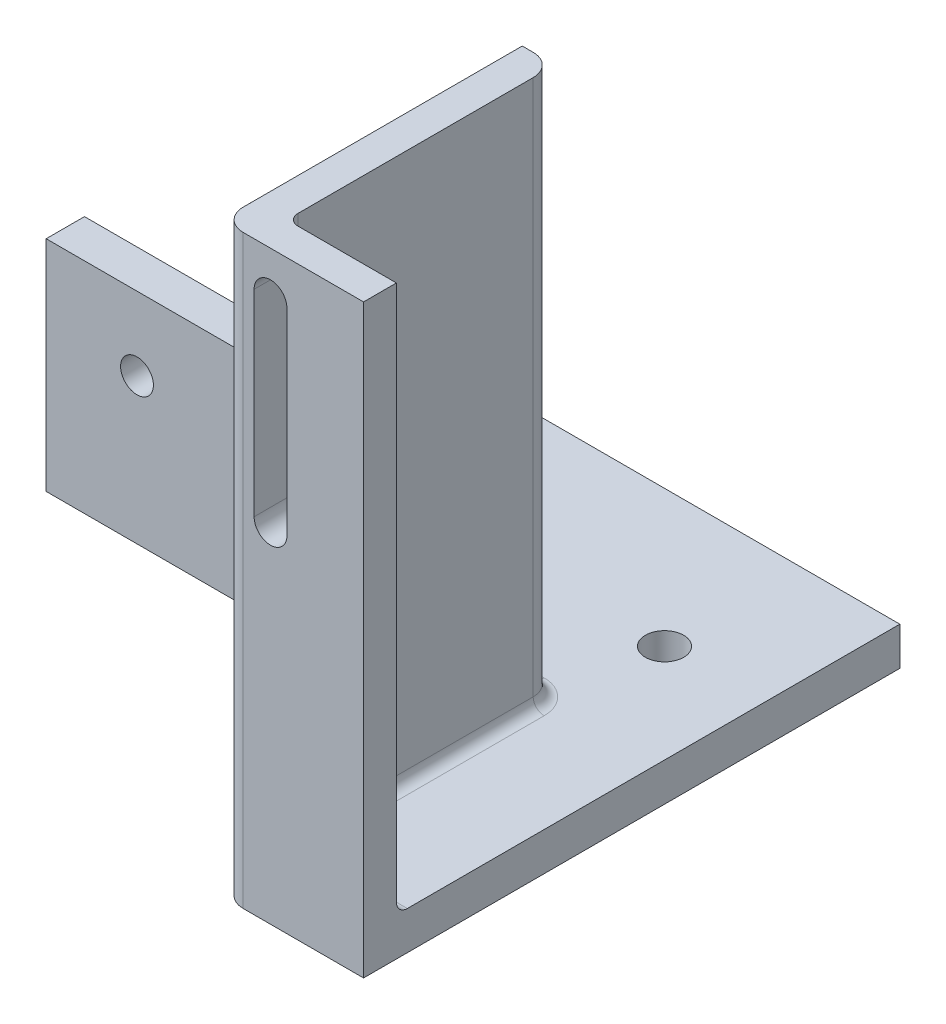
from build123d import *

# Parameters (mm, degrees)
BOSS_EXTRUDE2_DEPTH     = 40
CUT_EXTRUDE1_DEPTH      = 52.23475383
CUT_EXTRUDE1_DEPTH_BACK = 52.23475383
SKETCH4_R               = 1.5
SKETCH4_W               = 9.017
SKETCH4_H               = 4.572
BOSS_EXTRUDE5_DEPTH     = 3
BOSS_EXTRUDE6_DEPTH     = 10
CUT_EXTRUDE2_DEPTH      = 89.24539648
CUT_EXTRUDE2_DEPTH_BACK = 89.24539648
FILLET3_R               = 10
FILLET4_R               = 1
FILLET5_R               = 2
FILLET6_R               = 1
CUT_EXTRUDE3_DEPTH      = 80.348913103
CUT_EXTRUDE3_DEPTH_BACK = 80.348913103
SKETCH10_R              = 1.75


with BuildPart() as part:
    # Sketch3 → Boss-Extrude2 (new body)
    with BuildSketch(Plane(origin=(0, 0, 0), x_dir=(0, 0, -1), z_dir=(1, 0, 0))):
        Polygon((0, 0), (0, 20), (3.5, 20), (3.5, 3.5), (25, 3.5), (25, 0), align=None)
    extrude(amount=BOSS_EXTRUDE2_DEPTH)

    # Sketch4 → Cut-Extrude1 (cut, two sides: drawn at the far end of the back side and taken through both)
    with BuildSketch(Plane.XY.offset(-CUT_EXTRUDE1_DEPTH_BACK)):
        with Locations(Location((8.3, 13.3, 0), (0, 0, 270))):
            Circle(SKETCH4_R)
        with Locations(Location((31.7, 6.7, 0), (0, 0, 270))):
            Circle(SKETCH4_R)
        with Locations((28.3565, 15.6515)):
            Rectangle(SKETCH4_W, SKETCH4_H)
    extrude(amount=CUT_EXTRUDE1_DEPTH + CUT_EXTRUDE1_DEPTH_BACK, mode=Mode.SUBTRACT)

    # Sketch5 → Boss-Extrude5 (add)
    with BuildSketch(Plane(origin=(40, 0, 0), x_dir=(0, 0, -1), z_dir=(1, 0, 0))):
        Polygon((25, 0), (-24, 0), (-24, 3.5), (-24, 53.5), (3.5, 53.5), (3.5, 3.5), (25, 3.5), align=None)
    extrude(amount=BOSS_EXTRUDE5_DEPTH)

    # Sketch7 → Boss-Extrude6 (add)
    with BuildSketch(Plane(origin=(43, 0, 0), x_dir=(0, 0, -1), z_dir=(1, 0, 0))):
        Polygon((3.5, 3.5), (-21, 3.5), (-21, 0), (25, 0), (25, 3.5), align=None)
        Polygon((-21, 53.5), (-24, 53.5), (-24, 0), (-21, 0), (-21, 3.5), align=None)
    extrude(amount=BOSS_EXTRUDE6_DEPTH)

    # Sketch9 → Cut-Extrude2 (cut, two sides: drawn at the far end of the back side and taken through both)
    with BuildSketch(Plane(origin=(0, 0, 21), x_dir=(-1, 0, 0), z_dir=(0, 0, -1)).offset(-CUT_EXTRUDE2_DEPTH_BACK)):
        with BuildLine():
            Line((-46, 31.5), (-46, 49.5))
            ThreePointArc((-46, 49.5), (-44.5, 51), (-43, 49.5))
            Line((-43, 49.5), (-43, 31.5))
            ThreePointArc((-43, 31.5), (-44.5, 30), (-46, 31.5))
        make_face()
    extrude(amount=CUT_EXTRUDE2_DEPTH + CUT_EXTRUDE2_DEPTH_BACK, mode=Mode.SUBTRACT)

    # Fillet3
    fillet3_edges = [part.edges().sort_by_distance(p)[0] for p in [
        (40, 20, -1.75),
    ]]
    fillet(fillet3_edges, radius=FILLET3_R)

    # Fillet4
    fillet4_edges = [part.edges().sort_by_distance(p)[0] for p in [
        (43, 17.5, 21),
        (43, 51.5, 21),
    ]]
    fillet(fillet4_edges, radius=FILLET4_R)

    # Fillet5
    fillet5_edges = [part.edges().sort_by_distance(p)[0] for p in [
        (40, 15, 0),
        (40, 26.75, 24),
        (43, 28.5, -3.5),
    ]]
    fillet(fillet5_edges, radius=FILLET5_R)

    # Fillet6
    fillet6_edges = [part.edges().sort_by_distance(p)[0] for p in [
        (43.292893219, 3.5, 20.707106781),
        (43, 3.5, 9.25),
        (20.5, 3.5, -3.5),
        (42.414213562, 3.5, -2.914213562),
        (48.5, 3.5, 21),
    ]]
    fillet(fillet6_edges, radius=FILLET6_R)

    # Sketch10 → Cut-Extrude3 (cut, two sides: drawn at the far end of the back side and taken through both)
    with BuildSketch(Plane(origin=(0, 0, 0), x_dir=(-1, 0, 0), z_dir=(0, -1, 0)).offset(-CUT_EXTRUDE3_DEPTH_BACK)):
        with Locations(Location((-44, 12.5, 0), (0, 0, 90))):
            Circle(SKETCH10_R)
        with Locations(Location((-9, 12.5, 0), (0, 0, 90))):
            Circle(SKETCH10_R)
    extrude(amount=CUT_EXTRUDE3_DEPTH + CUT_EXTRUDE3_DEPTH_BACK, mode=Mode.SUBTRACT)


solid = part.part
